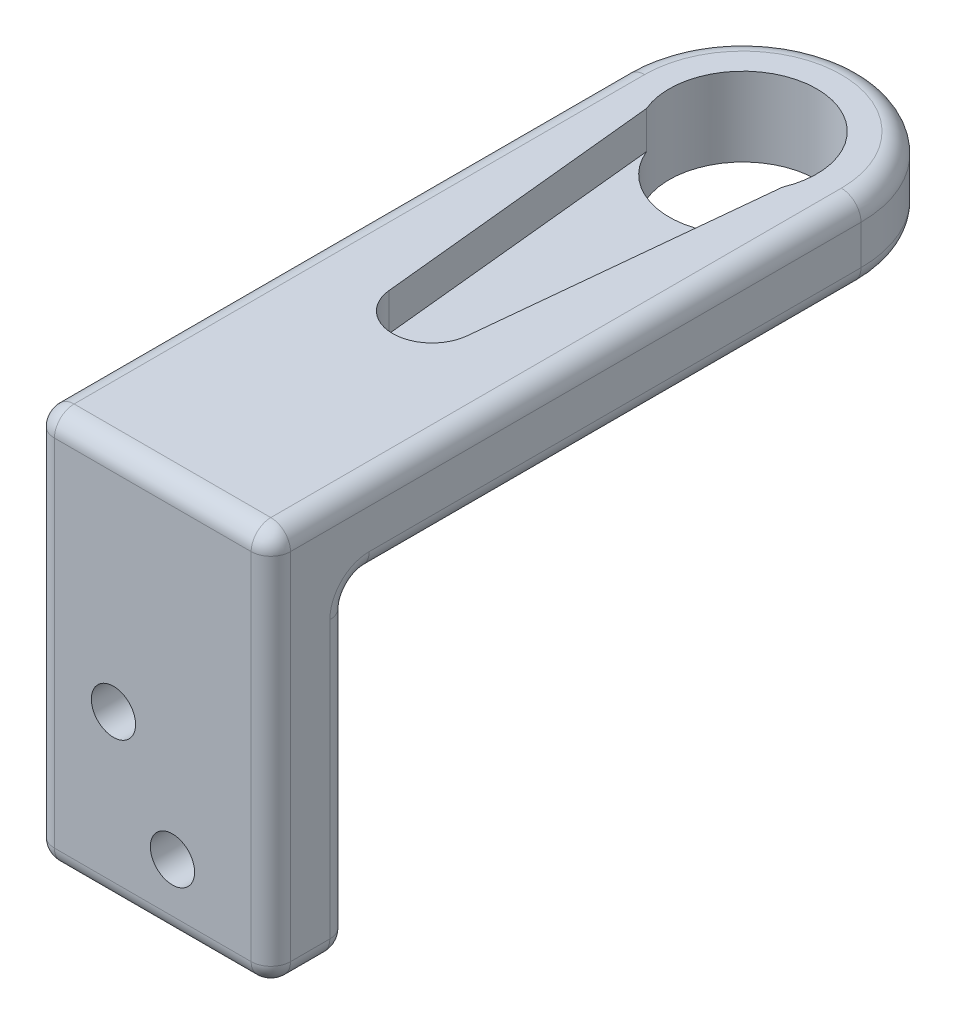
from build123d import *

# Parameters (mm, degrees)
PITCH_ARM_BASE_DEPTH          = 4
PITCH_ARM_MOUNTING_HOLE_REACH = 32.854
SKETCH2_R                     = 3.75
PITCH_ARM_SLOT_DEPTH          = 1.9
SKETCH5_W                     = 12
SKETCH5_H                     = 4
MOUNTING_BRACKET_DEPTH        = 16.05
BRACKET_MOUNTING_HOLES_REACH  = 38.299
SKETCH8_R                     = 1.125
F_1MM_FILLETS_R               = 1


with BuildPart() as part:
    # Sketch1 → Pitch Arm Base (new body)
    with BuildSketch(Plane(origin=(0, 0, 0), x_dir=(1, 0, 0), z_dir=(0, 1, 0))):
        with BuildLine():
            Line((-6, 0), (-6, -30))
            Line((-6, -30), (6, -30))
            Line((6, -30), (6, 0))
            ThreePointArc((6, 0), (0, 6), (-6, 0))
        make_face()
    extrude(amount=PITCH_ARM_BASE_DEPTH)

    # Sketch2 → Pitch Arm Mounting Hole (cut, up to next)
    with BuildSketch(Plane(origin=(0, 4, 0), x_dir=(1, 0, 0), z_dir=(0, 1, 0)), mode=Mode.PRIVATE) as pitch_arm_mounting_hole_sk1:
        with Locations(Location((0, 0, 0), (0, 0, 270))):
            Circle(SKETCH2_R)
    pitch_arm_mounting_hole_tool1 = extrude(pitch_arm_mounting_hole_sk1.sketch, amount=-PITCH_ARM_MOUNTING_HOLE_REACH, mode=Mode.PRIVATE) & part.part
    add(pitch_arm_mounting_hole_tool1.solids().sort_by_distance((0, 4, 0))[0], mode=Mode.SUBTRACT)

    # Sketch4 → Pitch Arm Slot (cut)
    with BuildSketch(Plane(origin=(0, 4, 0), x_dir=(1, 0, 0), z_dir=(0, 1, 0))):
        with BuildLine():
            Line((-3.46, -1.445994467), (-1.989882432, -16.005994467))
            ThreePointArc((-1.989882432, -16.005994467), (0, -17.805076808), (1.989882432, -16.005994467))
            Line((1.989882432, -16.005994467), (3.46, -1.445994467))
            ThreePointArc((3.46, -1.445994467), (0, -3.75), (-3.46, -1.445994467))
        make_face()
    extrude(amount=-PITCH_ARM_SLOT_DEPTH, mode=Mode.SUBTRACT)

    # Sketch5 → Mounting Bracket (add)
    with BuildSketch(Plane.XZ):
        with Locations((0, 28)):
            Rectangle(SKETCH5_W, SKETCH5_H)
    extrude(amount=MOUNTING_BRACKET_DEPTH)

    # Sketch8 → Bracket Mounting Holes (cut, up to next)
    with BuildSketch(Plane(origin=(0, 0, 26), x_dir=(-1, 0, 0), z_dir=(0, 0, -1)), mode=Mode.PRIVATE) as bracket_mounting_holes_sk1:
        with Locations((-1, -12.55)):
            Circle(SKETCH8_R)
    bracket_mounting_holes_tool1 = extrude(bracket_mounting_holes_sk1.sketch, amount=-BRACKET_MOUNTING_HOLES_REACH, mode=Mode.PRIVATE) & part.part
    # Sketch8 → Bracket Mounting Holes (cut, up to next)
    with BuildSketch(Plane(origin=(0, 0, 26), x_dir=(-1, 0, 0), z_dir=(0, 0, -1)), mode=Mode.PRIVATE) as bracket_mounting_holes_sk2:
        with Locations((2, -7.55)):
            Circle(SKETCH8_R)
    bracket_mounting_holes_tool2 = extrude(bracket_mounting_holes_sk2.sketch, amount=-BRACKET_MOUNTING_HOLES_REACH, mode=Mode.PRIVATE) & part.part
    add(bracket_mounting_holes_tool1.solids().sort_by_distance((1, -12.55, 26))[0], mode=Mode.SUBTRACT)
    add(bracket_mounting_holes_tool2.solids().sort_by_distance((-2, -7.55, 26))[0], mode=Mode.SUBTRACT)

    # 1mm Fillets
    f_1mm_fillets_edges = [part.edges().sort_by_distance(p)[0] for p in [
        (0, 4, 30),
        (6, 4, 15),
        (6, 0, 13),
        (0, 0, 26),
        (-6, -8.025, 26),
        (6, -8.025, 26),
        (-6, -16.05, 28),
        (0, -16.05, 26),
        (6, -16.05, 28),
        (0, -16.05, 30),
        (0, 4, -6),
        (-6, 0, 13),
        (0, 0, -6),
        (6, -6.025, 30),
        (-6, -6.025, 30),
        (-6, 4, 15),
    ]]
    fillet(f_1mm_fillets_edges, radius=F_1MM_FILLETS_R)


solid = part.part
